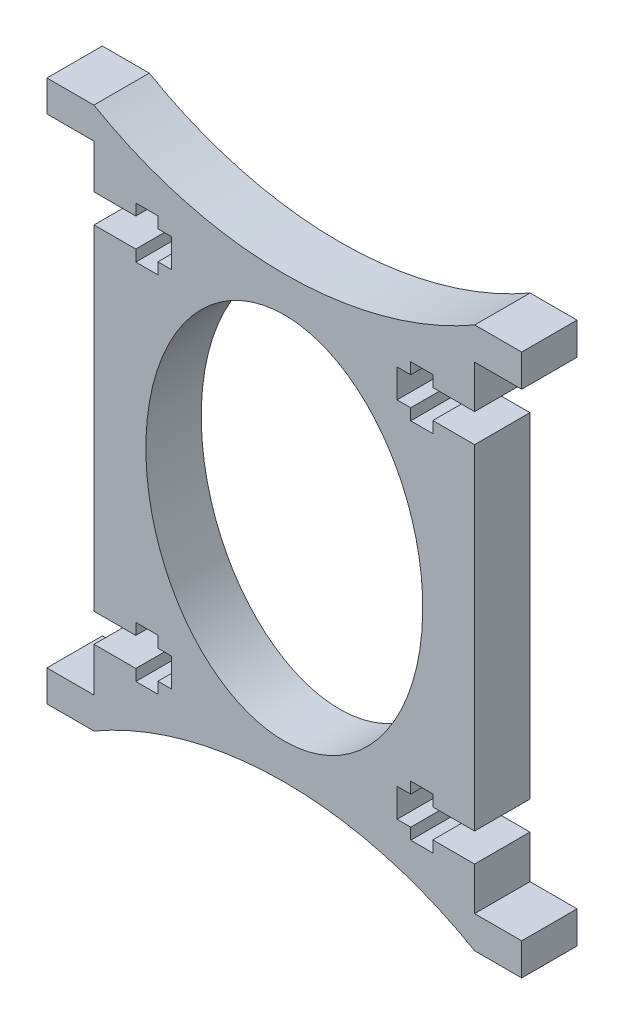
from build123d import *

# Parameters (mm, degrees)
SKETCH1_RX          = 20
SKETCH1_RY          = 15
BOSS_EXTRUDE1_DEPTH = 6


with BuildPart() as part:
    # Sketch1 → Boss-Extrude1 (new body)
    with BuildSketch(Plane.XY):
        with BuildLine():
            Line((735.278050496, 436.653824982), (737.672420097, 436.653824982))
            Line((737.672420097, 436.653824982), (737.672420097, 437.878226994))
            Line((737.672420097, 437.878226994), (742.197859342, 437.878226994))
            Line((742.197859342, 437.878226994), (742.197859342, 433.225591729))
            Line((742.197859342, 433.225591729), (747.299662794, 433.225591729))
            Line((747.299662794, 433.225591729), (747.299662794, 429.736067))
            Line((747.299662794, 429.736067), (742.213087036, 429.736067))
            ThreePointArc((742.213087036, 429.736067), (721.582691686, 435.262998961), (700.952296336, 429.736067))
            Line((700.952296336, 429.736067), (695.865635692, 429.736067))
            Line((695.865635692, 429.736067), (695.865635692, 433.116067))
            Line((695.865635692, 433.116067), (700.966852893, 433.116067))
            Line((700.966852893, 433.116067), (700.966852893, 437.878226994))
            Line((700.966852893, 437.878226994), (705.492292137, 437.878226994))
            Line((705.492292137, 437.878226994), (705.492292137, 436.653824982))
            Line((705.492292137, 436.653824982), (707.886661739, 436.653824982))
            Line((707.886661739, 436.653824982), (707.886661739, 437.878226994))
            Line((707.886661739, 437.878226994), (709.364764052, 437.878226994))
            Line((709.364764052, 437.878226994), (709.364764052, 440.973907006))
            Line((709.364764052, 440.973907006), (707.886661739, 440.973907006))
            Line((707.886661739, 440.973907006), (707.886661739, 442.198309018))
            Line((707.886661739, 442.198309018), (705.492292137, 442.198309018))
            Line((705.492292137, 442.198309018), (705.492292137, 440.973907006))
            Line((705.492292137, 440.973907006), (700.966852893, 440.973907006))
            Line((700.966852893, 440.973907006), (700.966852893, 459.101067))
            Line((700.966852893, 459.101067), (700.966852893, 477.228226994))
            Line((700.966852893, 477.228226994), (705.492292137, 477.228226994))
            Line((705.492292137, 477.228226994), (705.492292137, 476.003824982))
            Line((705.492292137, 476.003824982), (707.886661739, 476.003824982))
            Line((707.886661739, 476.003824982), (707.886661739, 477.228226994))
            Line((707.886661739, 477.228226994), (709.364764052, 477.228226994))
            Line((709.364764052, 477.228226994), (709.364764052, 480.323907006))
            Line((709.364764052, 480.323907006), (707.886661739, 480.323907006))
            Line((707.886661739, 480.323907006), (707.886661739, 481.548309018))
            Line((707.886661739, 481.548309018), (705.492292137, 481.548309018))
            Line((705.492292137, 481.548309018), (705.492292137, 480.323907006))
            Line((705.492292137, 480.323907006), (700.966852893, 480.323907006))
            Line((700.966852893, 480.323907006), (700.966852893, 485.086067))
            Line((700.966852893, 485.086067), (695.865635692, 485.086067))
            Line((695.865635692, 485.086067), (695.865635692, 488.466067))
            Line((695.865635692, 488.466067), (700.952296336, 488.466067))
            ThreePointArc((700.952296336, 488.466067), (721.582691686, 482.939135038), (742.213087036, 488.466067))
            Line((742.213087036, 488.466067), (747.299662794, 488.466067))
            Line((747.299662794, 488.466067), (747.299662794, 484.976542271))
            Line((747.299662794, 484.976542271), (742.197859342, 484.976542271))
            Line((742.197859342, 484.976542271), (742.197859342, 480.323907006))
            Line((742.197859342, 480.323907006), (737.672420097, 480.323907006))
            Line((737.672420097, 480.323907006), (737.672420097, 481.548309018))
            Line((737.672420097, 481.548309018), (735.278050496, 481.548309018))
            Line((735.278050496, 481.548309018), (735.278050496, 480.323907006))
            Line((735.278050496, 480.323907006), (733.799948182, 480.323907006))
            Line((733.799948182, 480.323907006), (733.799948182, 477.228226994))
            Line((733.799948182, 477.228226994), (735.278050496, 477.228226994))
            Line((735.278050496, 477.228226994), (735.278050496, 476.003824982))
            Line((735.278050496, 476.003824982), (737.672420097, 476.003824982))
            Line((737.672420097, 476.003824982), (737.672420097, 477.228226994))
            Line((737.672420097, 477.228226994), (742.197859342, 477.228226994))
            Line((742.197859342, 477.228226994), (742.197859342, 459.101067))
            Line((742.197859342, 459.101067), (742.197859342, 440.973907006))
            Line((742.197859342, 440.973907006), (737.672420097, 440.973907006))
            Line((737.672420097, 440.973907006), (737.672420097, 442.198309018))
            Line((737.672420097, 442.198309018), (735.278050496, 442.198309018))
            Line((735.278050496, 442.198309018), (735.278050496, 440.973907006))
            Line((735.278050496, 440.973907006), (733.799948182, 440.973907006))
            Line((733.799948182, 440.973907006), (733.799948182, 437.878226994))
            Line((733.799948182, 437.878226994), (735.278050496, 437.878226994))
            Line((735.278050496, 437.878226994), (735.278050496, 436.653824982))
        make_face()
        with Locations(Location((721.582356117, 459.101067), (0, 0, 90))):
            Ellipse(SKETCH1_RX, SKETCH1_RY, mode=Mode.SUBTRACT)
    extrude(amount=BOSS_EXTRUDE1_DEPTH)


solid = part.part
